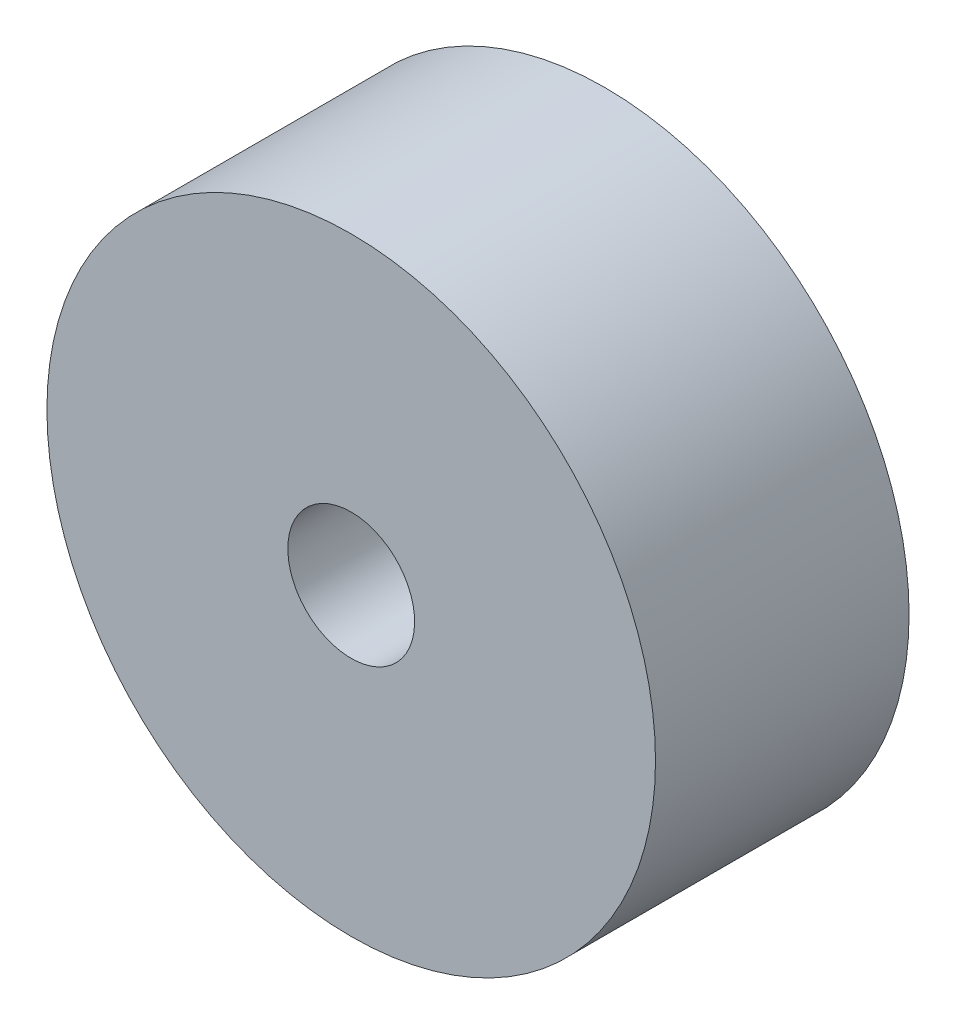
from build123d import *

# Parameters (mm, degrees)
SKETCH_1_W    = 4.75
SKETCH_1_H    = 5
SCALE_1_SCALE = 2


with BuildPart() as part:
    # 草图1 → 旋转1 (revolve)
    with BuildSketch(Plane.XZ, mode=Mode.PRIVATE) as revolve_1_sk:
        with Locations((2.625, 7.5)):
            Rectangle(SKETCH_1_W, SKETCH_1_H)
    revolve(revolve_1_sk.sketch.rotate(Axis((-1, 0, 10), (0, 0, -1)), 270), axis=Axis((-1, 0, 10), (0, 0, -1)))


with BuildPart() as part_1:
    # 缩放比例1: scaled about (-1, 0, 7.5)
    add(part.part.scale(SCALE_1_SCALE).moved(Location((1, 0, -7.5))))


solid = part_1.part
